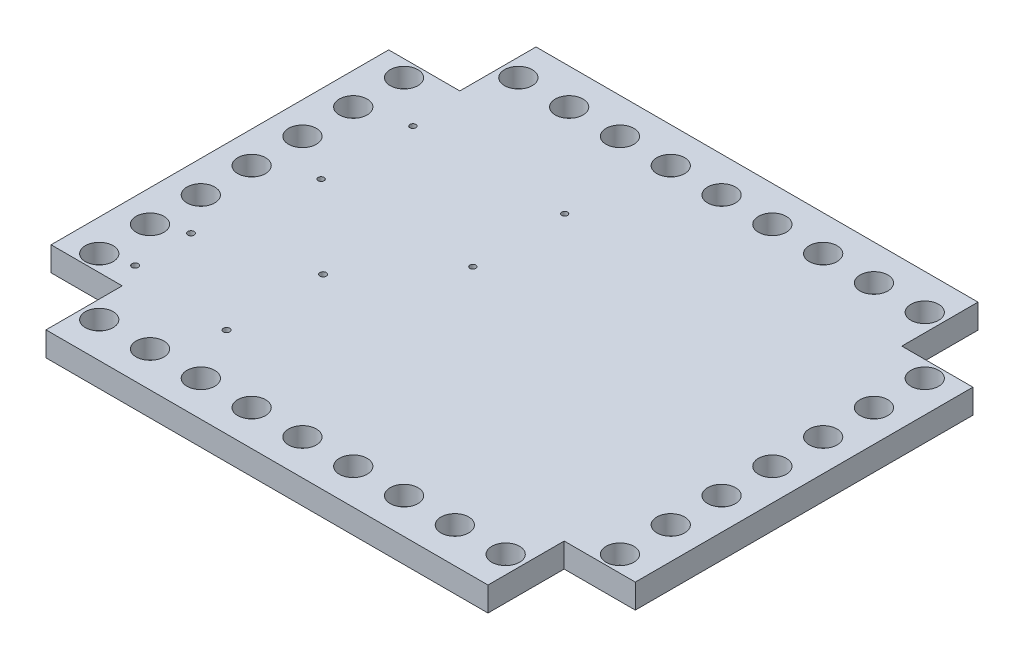
from build123d import *

# Parameters (mm, degrees)
BOSS_EXTRUDE1_DEPTH              = 9.652
SKETCH2_W                        = 35.55999999999999
SKETCH2_H                        = 38.099999999999994
CUT_EXTRUDE2_DEPTH               = 191.8664810908401
F_35_64_0_54688_DIAMETER_HOLE1_D = 13.890752
CUT_EXTRUDE3_DEPTH               = 191.8664810908401
CUT_EXTRUDE3_DEPTH_BACK          = 22.500000000000014
SKETCH7_R                        = 1.600000000000006
SKETCH7_R_2                      = 1.600000000000005
F_32_0_116_DIAMETER_HOLE2_D      = 2.9464
SKETCH12_R                       = 1.600000000000006
SKETCH12_R_2                     = 1.600000000000005
SKETCH12_R_3                     = 1.4731999999999996
SKETCH12_R_4                     = 1.4732
SKETCH12_R_5                     = 3.174999999999997
SKETCH12_R_6                     = 3.1749999999999954
SKETCH12_R_7                     = 3.175000000000005
BOSS_EXTRUDE3_DEPTH              = 2.5
SKETCH12_2_R                     = 1.600000000000006
SKETCH12_2_R_2                   = 1.600000000000005
SKETCH12_2_R_3                   = 1.4731999999999996
SKETCH12_2_R_4                   = 1.4732
SKETCH12_2_R_5                   = 3.174999999999997
SKETCH12_2_R_6                   = 3.1749999999999954
SKETCH12_2_R_7                   = 3.175000000000005
BOSS_EXTRUDE4_DEPTH              = 2.5


with BuildPart() as part:
    # Sketch1 → Boss-Extrude1 (new body)
    with BuildSketch(Plane(origin=(0, 0, 0), x_dir=(1, 0, 0), z_dir=(0, 1, 0))):
        Polygon((146.05, 122.50000000000006), (-146.04999999999995, 122.49999999999997), (-146.04999999999993, -122.50000000000003), (146.05000000000004, -122.5), align=None)
    extrude(amount=BOSS_EXTRUDE1_DEPTH)

    # Sketch2 → Cut-Extrude2 (cut, through all)
    with BuildSketch(Plane(origin=(0, 9.652, 0), x_dir=(1, 0, 0), z_dir=(0, 1, 0))):
        with Locations((-128.26999999999995, 103.44999999999997)):
            Rectangle(SKETCH2_W, SKETCH2_H)
        Polygon((146.04999999999995, 84.40000000000002), (146.05, 122.50000000000006), (110.48999999999997, 122.5), (110.48999999999997, 84.4), align=None)
        Polygon((146.05000000000004, -122.5), (110.48999999999997, -122.5), (110.48999999999997, -84.4), (146.04999999999995, -84.40000000000002), align=None)
        Polygon((-146.0499999999999, -84.40000000000006), (-146.04999999999993, -122.50000000000003), (-110.48999999999991, -122.50000000000003), (-110.48999999999991, -84.40000000000003), align=None)
    extrude(amount=-CUT_EXTRUDE2_DEPTH, mode=Mode.SUBTRACT)

    # 35/64 (0.54688) Diameter Hole1 (through all)
    with Locations(Plane(origin=(0, 9.652, 0), x_dir=(1, 0, 0), z_dir=(0, 1, 0))):
        with Locations((-101.6, -104.775), (-25.4, 104.775), (0, 104.775), (-130.175, 0), (-50.8, 104.775), (-76.2, 104.775), (76.2, 104.775), (50.8, 104.775), (25.4, 104.775), (76.2, -104.775), (50.8, -104.775), (25.4, -104.775), (0, -104.775), (-25.4, -104.775), (-50.8, -104.775), (-76.2, -104.775), (-130.175, 25.4), (-130.175, 50.8), (-130.175, -50.8), (-130.175, -25.4), (130.175, -50.8), (130.175, -25.4), (130.175, 0), (130.175, 25.4), (130.175, 50.8), (-130.175, 76.2), (130.175, 76.2), (130.175, -76.2), (-130.175, -76.2), (-101.6, 104.775), (101.6, 104.775), (101.6, -104.775)):
            Hole(F_35_64_0_54688_DIAMETER_HOLE1_D / 2)

    # Sketch7 → Cut-Extrude3 (cut, two sides: drawn at the far end of the back side and taken through both)
    with BuildSketch(Plane(origin=(0, 9.652, 0), x_dir=(1, 0, 0), z_dir=(0, 1, 0)).offset(-CUT_EXTRUDE3_DEPTH_BACK)):
        with Locations((-116.04999999999995, -44.44000000000001)):
            Circle(SKETCH7_R)
        with Locations((-116.04999999999995, -72.38000000000001)):
            Circle(SKETCH7_R)
        with Locations((-65.24999999999997, -77.46000000000001)):
            Circle(SKETCH7_R)
        with Locations((-65.24999999999997, -29.20000000000001)):
            Circle(SKETCH7_R_2)
    extrude(amount=CUT_EXTRUDE3_DEPTH + CUT_EXTRUDE3_DEPTH_BACK, mode=Mode.SUBTRACT)

    # #32 (0.116) Diameter Hole2 (through all)
    with Locations(Plane(origin=(0, 9.652, 0), x_dir=(1, 0, 0), z_dir=(0, 1, 0))):
        with Locations((-106.989339828, 57.439339828), (-31.110660172, 57.439339828), (-31.110660172, 11.560660172), (-106.989339828, 11.560660172)):
            Hole(F_32_0_116_DIAMETER_HOLE2_D / 2)

    # Sketch12 → Boss-Extrude3 (add)
    with BuildSketch(Plane.XZ):
        Polygon((-146.0499999999999, 84.40000000000006), (-110.48999999999991, 84.40000000000003), (-110.48999999999991, 122.50000000000003), (110.48999999999997, 122.5), (110.48999999999997, 84.4), (146.04999999999995, 84.40000000000002), (146.04999999999995, -84.40000000000002), (110.48999999999997, -84.4), (110.48999999999997, -122.5), (-110.48999999999997, -122.49999999999997), (-110.48999999999997, -84.39999999999998), (-146.04999999999995, -84.39999999999998), align=None)
        with Locations((-65.24999999999997, 77.46000000000001)):
            Circle(SKETCH12_R, mode=Mode.SUBTRACT)
        with Locations((-116.04999999999995, 72.38000000000001)):
            Circle(SKETCH12_R, mode=Mode.SUBTRACT)
        with Locations((-116.04999999999995, 44.44000000000001)):
            Circle(SKETCH12_R, mode=Mode.SUBTRACT)
        with Locations((-65.24999999999997, 29.20000000000001)):
            Circle(SKETCH12_R_2, mode=Mode.SUBTRACT)
        with Locations((-106.98933982822012, -11.560660171779812)):
            Circle(SKETCH12_R_3, mode=Mode.SUBTRACT)
        with Locations((-31.11066017177974, -11.56066017177984)):
            Circle(SKETCH12_R_4, mode=Mode.SUBTRACT)
        with Locations((-31.110660171779756, -57.43933982822016)):
            Circle(SKETCH12_R_4, mode=Mode.SUBTRACT)
        with Locations((-106.98933982822014, -57.43933982822016)):
            Circle(SKETCH12_R_4, mode=Mode.SUBTRACT)
        with Locations((-101.6, 104.77499999999998)):
            Circle(SKETCH12_R_5, mode=Mode.SUBTRACT)
        with Locations((-76.19999999999999, 104.77499999999998)):
            Circle(SKETCH12_R_5, mode=Mode.SUBTRACT)
        with Locations((-50.8, 104.77499999999998)):
            Circle(SKETCH12_R_5, mode=Mode.SUBTRACT)
        with Locations((-25.400000000000006, 104.77499999999998)):
            Circle(SKETCH12_R_5, mode=Mode.SUBTRACT)
        with Locations((0, 104.77499999999998)):
            Circle(SKETCH12_R_5, mode=Mode.SUBTRACT)
        with Locations((25.400000000000006, 104.77499999999998)):
            Circle(SKETCH12_R_5, mode=Mode.SUBTRACT)
        with Locations((50.79999999999998, 104.77499999999998)):
            Circle(SKETCH12_R_5, mode=Mode.SUBTRACT)
        with Locations((76.19999999999999, 104.77499999999998)):
            Circle(SKETCH12_R_5, mode=Mode.SUBTRACT)
        with Locations((101.6, 104.77499999999998)):
            Circle(SKETCH12_R_5, mode=Mode.SUBTRACT)
        with Locations((101.59999999999988, -104.77500000000003)):
            Circle(SKETCH12_R_5, mode=Mode.SUBTRACT)
        with Locations((76.19999999999987, -104.77500000000003)):
            Circle(SKETCH12_R_5, mode=Mode.SUBTRACT)
        with Locations((50.7999999999999, -104.775)):
            Circle(SKETCH12_R_5, mode=Mode.SUBTRACT)
        with Locations((25.39999999999993, -104.775)):
            Circle(SKETCH12_R_5, mode=Mode.SUBTRACT)
        with Locations((-5.973e-14, -104.77499999999998)):
            Circle(SKETCH12_R_6, mode=Mode.SUBTRACT)
        with Locations((-25.400000000000055, -104.77499999999995)):
            Circle(SKETCH12_R_7, mode=Mode.SUBTRACT)
        with Locations((-50.800000000000026, -104.77499999999995)):
            Circle(SKETCH12_R_5, mode=Mode.SUBTRACT)
        with Locations((-76.19999999999999, -104.77499999999992)):
            Circle(SKETCH12_R_5, mode=Mode.SUBTRACT)
        with Locations((-101.6, -104.77499999999992)):
            Circle(SKETCH12_R_5, mode=Mode.SUBTRACT)
        with Locations((-130.17499999999998, 76.19999999999999)):
            Circle(SKETCH12_R_5, mode=Mode.SUBTRACT)
        with Locations((-130.1749999999997, 50.79999999999999)):
            Circle(SKETCH12_R_5, mode=Mode.SUBTRACT)
        with Locations((-130.17499999999947, 25.39999999999999)):
            Circle(SKETCH12_R_5, mode=Mode.SUBTRACT)
        with Locations((-130.1749999999992, 0)):
            Circle(SKETCH12_R_5, mode=Mode.SUBTRACT)
        with Locations((-130.17499999999893, -25.400000000000006)):
            Circle(SKETCH12_R_5, mode=Mode.SUBTRACT)
        with Locations((-130.17499999999865, -50.80000000000001)):
            Circle(SKETCH12_R_5, mode=Mode.SUBTRACT)
        with Locations((-130.1749999999984, -76.19999999999999)):
            Circle(SKETCH12_R_5, mode=Mode.SUBTRACT)
        with Locations((130.17499999999833, -76.19999999999993)):
            Circle(SKETCH12_R_5, mode=Mode.SUBTRACT)
        with Locations((130.17499999999865, -50.799999999999955)):
            Circle(SKETCH12_R_5, mode=Mode.SUBTRACT)
        with Locations((130.17499999999893, -25.39999999999995)):
            Circle(SKETCH12_R_5, mode=Mode.SUBTRACT)
        with Locations((130.1749999999992, 0)):
            Circle(SKETCH12_R_5, mode=Mode.SUBTRACT)
        with Locations((130.17499999999947, 25.39999999999999)):
            Circle(SKETCH12_R_5, mode=Mode.SUBTRACT)
        with Locations((130.1749999999997, 50.79999999999999)):
            Circle(SKETCH12_R_5, mode=Mode.SUBTRACT)
        with Locations((130.17500000000004, 76.19999999999996)):
            Circle(SKETCH12_R_5, mode=Mode.SUBTRACT)
    extrude(amount=BOSS_EXTRUDE3_DEPTH)

    # Sketch12<2> → Boss-Extrude4 (add)
    with BuildSketch(Plane.XZ):
        Polygon((-146.0499999999999, 84.40000000000006), (-110.48999999999991, 84.40000000000003), (-110.48999999999991, 122.50000000000003), (110.48999999999997, 122.5), (110.48999999999997, 84.4), (146.04999999999995, 84.40000000000002), (146.04999999999995, -84.40000000000002), (110.48999999999997, -84.4), (110.48999999999997, -122.5), (-110.48999999999997, -122.49999999999997), (-110.48999999999997, -84.39999999999998), (-146.04999999999995, -84.39999999999998), align=None)
        with Locations((-65.24999999999997, 77.46000000000001)):
            Circle(SKETCH12_2_R, mode=Mode.SUBTRACT)
        with Locations((-116.04999999999995, 72.38000000000001)):
            Circle(SKETCH12_2_R, mode=Mode.SUBTRACT)
        with Locations((-116.04999999999995, 44.44000000000001)):
            Circle(SKETCH12_2_R, mode=Mode.SUBTRACT)
        with Locations((-65.24999999999997, 29.20000000000001)):
            Circle(SKETCH12_2_R_2, mode=Mode.SUBTRACT)
        with Locations((-106.98933982822012, -11.560660171779812)):
            Circle(SKETCH12_2_R_3, mode=Mode.SUBTRACT)
        with Locations((-31.11066017177974, -11.56066017177984)):
            Circle(SKETCH12_2_R_4, mode=Mode.SUBTRACT)
        with Locations((-31.110660171779756, -57.43933982822016)):
            Circle(SKETCH12_2_R_4, mode=Mode.SUBTRACT)
        with Locations((-106.98933982822014, -57.43933982822016)):
            Circle(SKETCH12_2_R_4, mode=Mode.SUBTRACT)
        with Locations((-101.6, 104.77499999999998)):
            Circle(SKETCH12_2_R_5, mode=Mode.SUBTRACT)
        with Locations((-76.19999999999999, 104.77499999999998)):
            Circle(SKETCH12_2_R_5, mode=Mode.SUBTRACT)
        with Locations((-50.8, 104.77499999999998)):
            Circle(SKETCH12_2_R_5, mode=Mode.SUBTRACT)
        with Locations((-25.400000000000006, 104.77499999999998)):
            Circle(SKETCH12_2_R_5, mode=Mode.SUBTRACT)
        with Locations((0, 104.77499999999998)):
            Circle(SKETCH12_2_R_5, mode=Mode.SUBTRACT)
        with Locations((25.400000000000006, 104.77499999999998)):
            Circle(SKETCH12_2_R_5, mode=Mode.SUBTRACT)
        with Locations((50.79999999999998, 104.77499999999998)):
            Circle(SKETCH12_2_R_5, mode=Mode.SUBTRACT)
        with Locations((76.19999999999999, 104.77499999999998)):
            Circle(SKETCH12_2_R_5, mode=Mode.SUBTRACT)
        with Locations((101.6, 104.77499999999998)):
            Circle(SKETCH12_2_R_5, mode=Mode.SUBTRACT)
        with Locations((101.59999999999988, -104.77500000000003)):
            Circle(SKETCH12_2_R_5, mode=Mode.SUBTRACT)
        with Locations((76.19999999999987, -104.77500000000003)):
            Circle(SKETCH12_2_R_5, mode=Mode.SUBTRACT)
        with Locations((50.7999999999999, -104.775)):
            Circle(SKETCH12_2_R_5, mode=Mode.SUBTRACT)
        with Locations((25.39999999999993, -104.775)):
            Circle(SKETCH12_2_R_5, mode=Mode.SUBTRACT)
        with Locations((-5.973e-14, -104.77499999999998)):
            Circle(SKETCH12_2_R_6, mode=Mode.SUBTRACT)
        with Locations((-25.400000000000055, -104.77499999999995)):
            Circle(SKETCH12_2_R_7, mode=Mode.SUBTRACT)
        with Locations((-50.800000000000026, -104.77499999999995)):
            Circle(SKETCH12_2_R_5, mode=Mode.SUBTRACT)
        with Locations((-76.19999999999999, -104.77499999999992)):
            Circle(SKETCH12_2_R_5, mode=Mode.SUBTRACT)
        with Locations((-101.6, -104.77499999999992)):
            Circle(SKETCH12_2_R_5, mode=Mode.SUBTRACT)
        with Locations((-130.17499999999998, 76.19999999999999)):
            Circle(SKETCH12_2_R_5, mode=Mode.SUBTRACT)
        with Locations((-130.1749999999997, 50.79999999999999)):
            Circle(SKETCH12_2_R_5, mode=Mode.SUBTRACT)
        with Locations((-130.17499999999947, 25.39999999999999)):
            Circle(SKETCH12_2_R_5, mode=Mode.SUBTRACT)
        with Locations((-130.1749999999992, 0)):
            Circle(SKETCH12_2_R_5, mode=Mode.SUBTRACT)
        with Locations((-130.17499999999893, -25.400000000000006)):
            Circle(SKETCH12_2_R_5, mode=Mode.SUBTRACT)
        with Locations((-130.17499999999865, -50.80000000000001)):
            Circle(SKETCH12_2_R_5, mode=Mode.SUBTRACT)
        with Locations((-130.1749999999984, -76.19999999999999)):
            Circle(SKETCH12_2_R_5, mode=Mode.SUBTRACT)
        with Locations((130.17499999999833, -76.19999999999993)):
            Circle(SKETCH12_2_R_5, mode=Mode.SUBTRACT)
        with Locations((130.17499999999865, -50.799999999999955)):
            Circle(SKETCH12_2_R_5, mode=Mode.SUBTRACT)
        with Locations((130.17499999999893, -25.39999999999995)):
            Circle(SKETCH12_2_R_5, mode=Mode.SUBTRACT)
        with Locations((130.1749999999992, 0)):
            Circle(SKETCH12_2_R_5, mode=Mode.SUBTRACT)
        with Locations((130.17499999999947, 25.39999999999999)):
            Circle(SKETCH12_2_R_5, mode=Mode.SUBTRACT)
        with Locations((130.1749999999997, 50.79999999999999)):
            Circle(SKETCH12_2_R_5, mode=Mode.SUBTRACT)
        with Locations((130.17500000000004, 76.19999999999996)):
            Circle(SKETCH12_2_R_5, mode=Mode.SUBTRACT)
    extrude(amount=BOSS_EXTRUDE4_DEPTH)


solid = part.part
